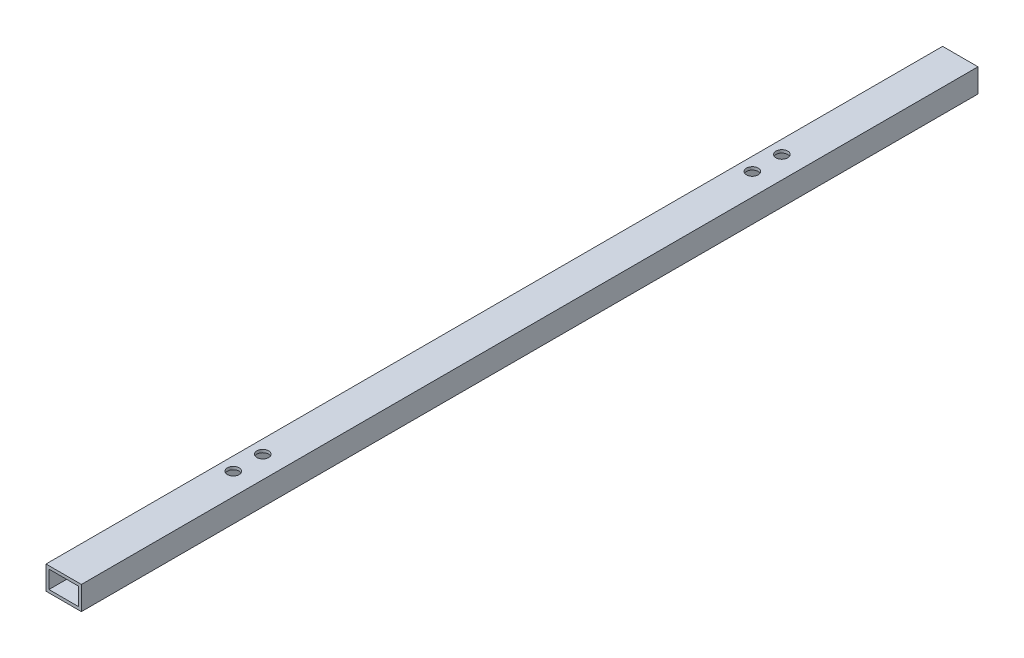
from build123d import *

# Parameters (mm, degrees)
BOSS_EXTRUDE1_DEPTH      = 482.6
BOSS_EXTRUDE1_DEPTH_BACK = 482.6
SKETCH3_W                = 38.1
SKETCH3_H                = 25.4
SKETCH3_W_2              = 31.75
SKETCH3_H_2              = 19.05
SKETCH6_R                = 6.35
CUT_EXTRUDE1_DEPTH       = 484.643280218


with BuildPart() as part:
    # Sketch3 → Boss-Extrude1 (new, two sides: drawn at the far end of the back side and taken through both)
    with BuildSketch(Plane.XY.offset(-BOSS_EXTRUDE1_DEPTH_BACK)):
        Rectangle(SKETCH3_W, SKETCH3_H)
        Rectangle(SKETCH3_W_2, SKETCH3_H_2, mode=Mode.SUBTRACT)
    extrude(amount=BOSS_EXTRUDE1_DEPTH + BOSS_EXTRUDE1_DEPTH_BACK)

    # Sketch6 → Cut-Extrude1 (cut, through all)
    with BuildSketch(Plane(origin=(0, 12.7, 0), x_dir=(1, 0, 0), z_dir=(0, 1, 0))):
        with Locations(Location((-4.7625, -263.525, 0), (0, 0, 270))):
            Circle(SKETCH6_R)
        with Locations(Location((-4.7625, -295.275, 0), (0, 0, 270))):
            Circle(SKETCH6_R)
        with Locations(Location((-4.7625, 295.275, 0), (0, 0, 270))):
            Circle(SKETCH6_R)
        with Locations(Location((-4.7625, 263.525, 0), (0, 0, 270))):
            Circle(SKETCH6_R)
    extrude(amount=-CUT_EXTRUDE1_DEPTH, mode=Mode.SUBTRACT)


solid = part.part
